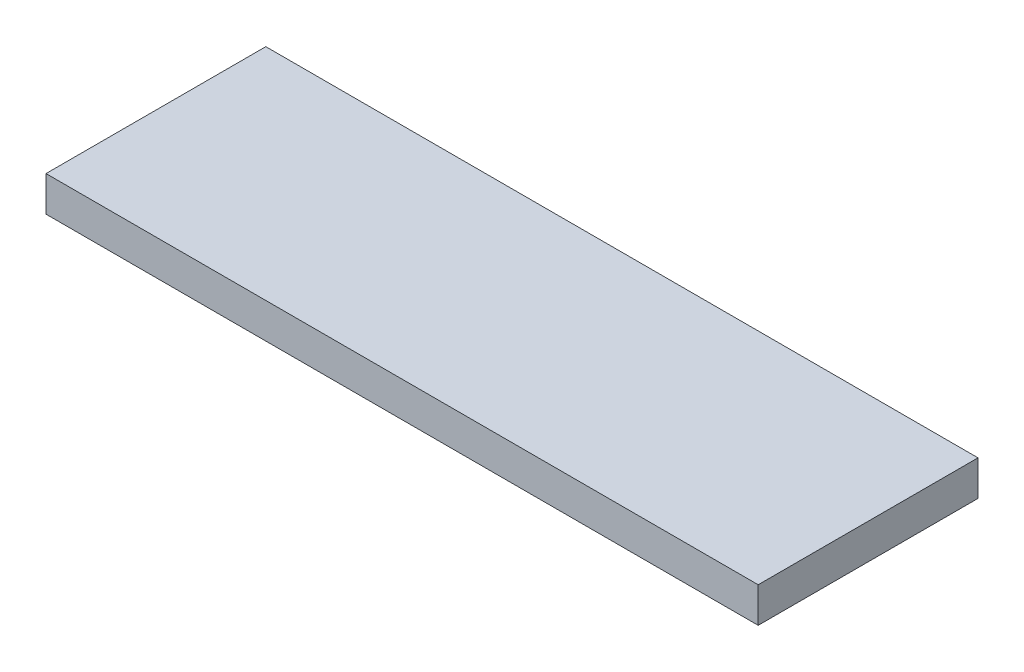
from build123d import *

# Parameters (mm, degrees)
SKETCH_1_W         = 81
SKETCH_1_H         = 4
BLOCKEXTRUDE_DEPTH = 25


with BuildPart() as part:
    # 草图1 → BlockExtrude (new body)
    with BuildSketch(Plane.XY):
        with Locations((40.5, 2)):
            Rectangle(SKETCH_1_W, SKETCH_1_H)
    extrude(amount=BLOCKEXTRUDE_DEPTH)


solid = part.part
